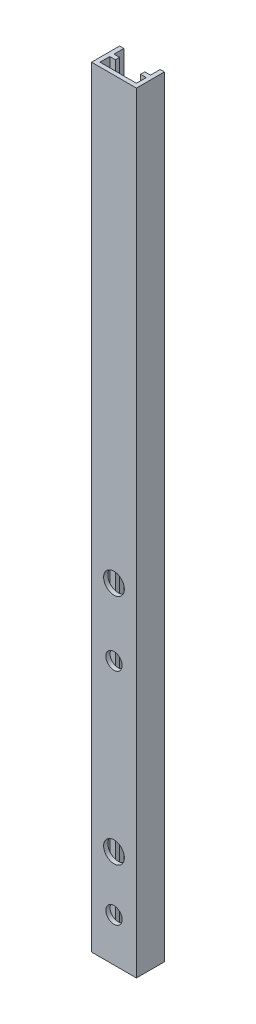
from build123d import *

# Parameters (mm, degrees)
SKETCH1_W           = 16
SKETCH1_H           = 10
BOSS_EXTRUDE1_DEPTH = 275
CUT_EXTRUDE1_DEPTH  = 275
SKETCH3_R           = 2.9
SKETCH3_R_2         = 3.7
CUT_EXTRUDE2_DEPTH  = 276.646512766


with BuildPart() as part:
    # Sketch1 → Boss-Extrude1 (new body)
    with BuildSketch(Plane(origin=(0, 0, 0), x_dir=(1, 0, 0), z_dir=(0, 1, 0))):
        with Locations((8, -5)):
            Rectangle(SKETCH1_W, SKETCH1_H)
    extrude(amount=BOSS_EXTRUDE1_DEPTH)

    # Sketch2 → Cut-Extrude1 (cut)
    with BuildSketch(Plane(origin=(0, 275, 0), x_dir=(1, 0, 0), z_dir=(0, 1, 0))):
        Polygon((1.5, 0), (1.5, -3.5), (3.5, -3.5), (3.5, -5), (1.5, -5), (1.5, -8.5), (14.5, -8.5), (14.5, -5), (12.5, -5), (12.5, -3.5), (14.5, -3.5), (14.5, 0), align=None)
    extrude(amount=-CUT_EXTRUDE1_DEPTH, mode=Mode.SUBTRACT)

    # Sketch3 → Cut-Extrude2 (cut, through all)
    with BuildSketch(Plane.XY.offset(10)):
        with Locations((8, 15.5)):
            Circle(SKETCH3_R)
        with Locations((8, 35)):
            Circle(SKETCH3_R_2)
        with Locations((8, 94)):
            Circle(SKETCH3_R)
        with Locations((8, 118)):
            Circle(SKETCH3_R_2)
    extrude(amount=-CUT_EXTRUDE2_DEPTH, mode=Mode.SUBTRACT)


solid = part.part
